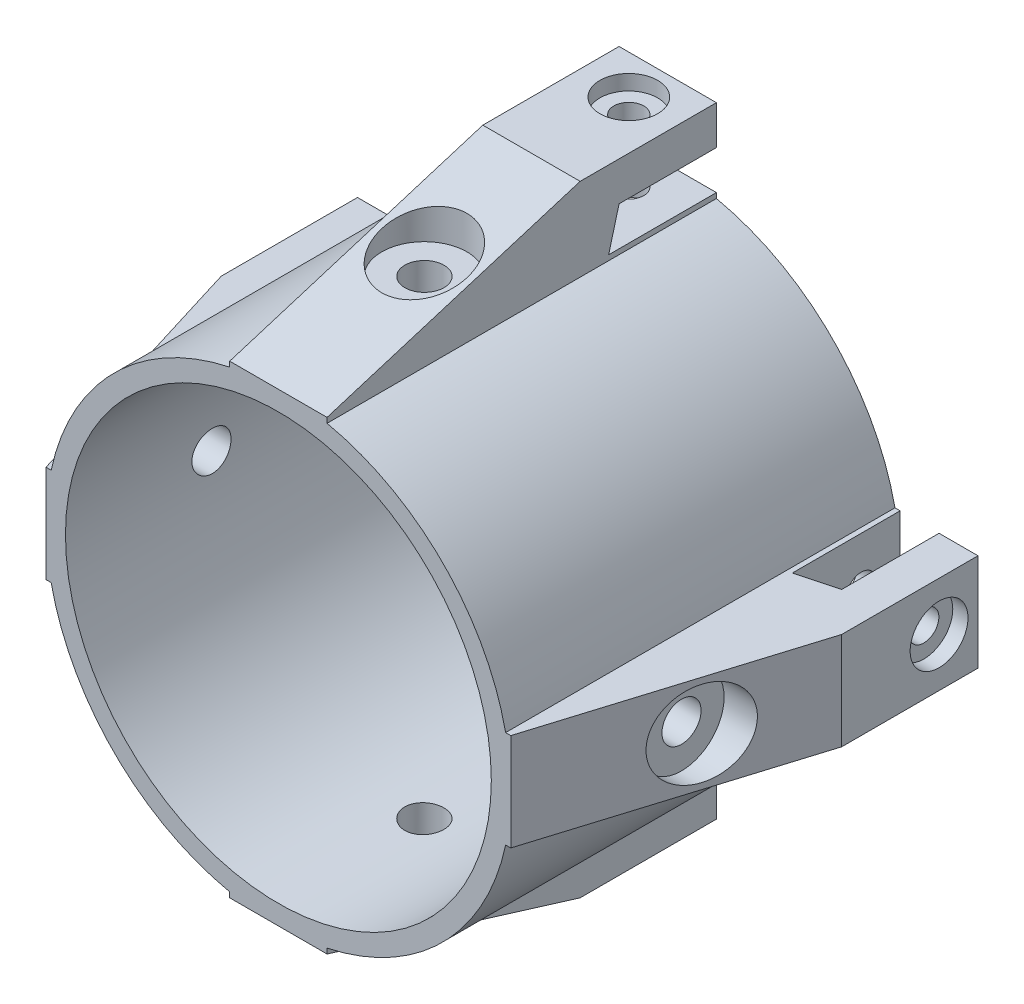
from build123d import *

# Parameters (mm, degrees)
SKETCH3_R         = 30.32125
SKETCH3_R_2       = 27.78125
BASE_RING_DEPTH   = 50.8
HOOK_DEPTH        = 6.35
CIRPATTERN1_COUNT = 4


with BuildPart() as part:
    # Sketch3 → base_ring (new body)
    with BuildSketch(Plane(origin=(0, 0, 0), x_dir=(0, 1, 0), z_dir=(0, 0, 1))):
        with Locations(Location((0, 0, 0), (0, 0, 270))):
            Circle(SKETCH3_R)
        with Locations(Location((0, 0, 0), (0, 0, 270))):
            Circle(SKETCH3_R_2, mode=Mode.SUBTRACT)
    extrude(amount=BASE_RING_DEPTH)

    # Sketch6 → hook (add, symmetric)
    with BuildSketch(Plane.YZ):
        Polygon((27.78125, 50.8), (27.78125, 0), (30.32125, 0), (30.32125, 14.061181898), (35.40125, 12.7), (35.40125, 0), (40.48125, 0), (40.48125, 17.78), (30.32125, 50.8), align=None)
    hook = extrude(amount=HOOK_DEPTH, both=True)

    # Sketch8 → CBORE for #5 Binding Head Machine Screw1 (revolve, cut)
    with BuildSketch(Plane(origin=(0, 40.48125, 5.08), x_dir=(0, 0, 1), z_dir=(1, 0, 0))):
        Polygon((0, 0), (0, 39.275163199), (1.9558, 38.1), (1.9558, 1.9812), (3.77063, 1.9812), (3.77063, 0), align=None)
    cbore_for_5_binding_head_machine_screw1 = revolve(axis=Axis((0, 46.83125, 5.08), (0, -1, 0)), mode=Mode.SUBTRACT)

    # Sketch10 → CBORE for #10 Binding Head Machine Screw2 (revolve, cut)
    with BuildSketch(Plane(origin=(0, 40.48125, 31.75), x_dir=(0, 0, 1), z_dir=(1, 0, 0))):
        Polygon((0, 0), (0, 39.633816902), (2.5527, 38.1), (2.5527, 6.9342), (5.55625, 6.9342), (5.55625, 0), align=None)
    cbore_for_10_binding_head_machine_screw = revolve(axis=Axis((0, 46.83125, 31.75), (0, -1, 0)), mode=Mode.SUBTRACT)

    # CirPattern1: hook, CBORE for #5 Binding Head Machine Screw1, CBORE for #10 Binding Head Machine Screw2 ×4 about axis
    cirpattern1_axis = Axis((0, 0, 0), (0, 0, 1))
    add([hook.rotate(cirpattern1_axis, i * 360 / CIRPATTERN1_COUNT) for i in range(1, CIRPATTERN1_COUNT)])
    add([cbore_for_5_binding_head_machine_screw1.rotate(cirpattern1_axis, i * 360 / CIRPATTERN1_COUNT) for i in range(1, CIRPATTERN1_COUNT)], mode=Mode.SUBTRACT)
    add([cbore_for_10_binding_head_machine_screw.rotate(cirpattern1_axis, i * 360 / CIRPATTERN1_COUNT) for i in range(1, CIRPATTERN1_COUNT)], mode=Mode.SUBTRACT)


solid = part.part
